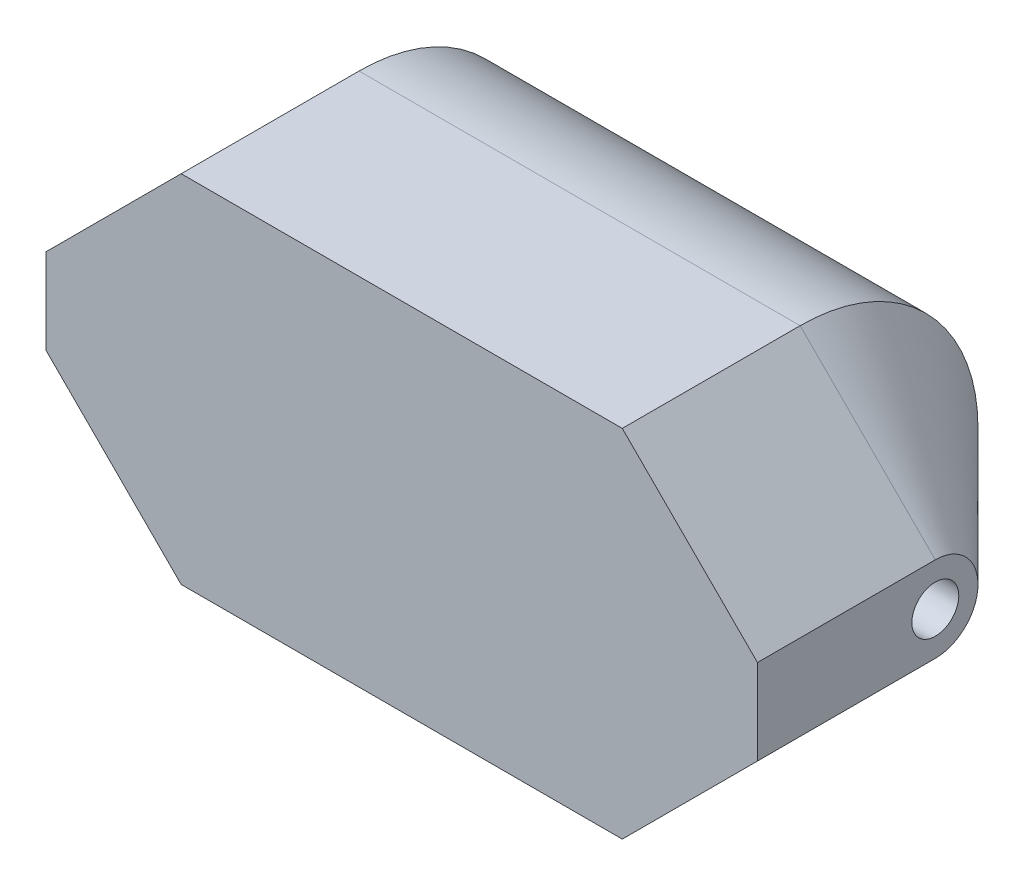
from build123d import *

# Parameters (mm, degrees)
SKETCH1_R           = 1.65
BOSS_EXTRUDE1_DEPTH = 50
CHAMFER1_SIZE       = 9.5


with BuildPart() as part:
    # Sketch1 → Boss-Extrude1 (new body)
    with BuildSketch(Plane(origin=(0, 0, 0), x_dir=(0, 0, -1), z_dir=(1, 0, 0))):
        with BuildLine():
            Line((0, 12.5), (-12.5, 12.5))
            Line((-12.5, 12.5), (-12.5, -12.5))
            Line((-12.5, -12.5), (0, -12.5))
            ThreePointArc((0, -12.5), (12.5, 0), (0, 12.5))
        make_face()
        Circle(SKETCH1_R, mode=Mode.SUBTRACT)
    extrude(amount=BOSS_EXTRUDE1_DEPTH)

    # Chamfer1
    chamfer1_edges = [part.edges().sort_by_distance(p)[0] for p in [
        (50, 12.5, 6.25),
        (50, -12.5, 6.25),
        (0, 12.5, 6.25),
        (0, 0, -12.5),
        (0, -12.5, 6.25),
        (50, 0, -12.5),
    ]]
    chamfer(chamfer1_edges, length=CHAMFER1_SIZE)


solid = part.part
